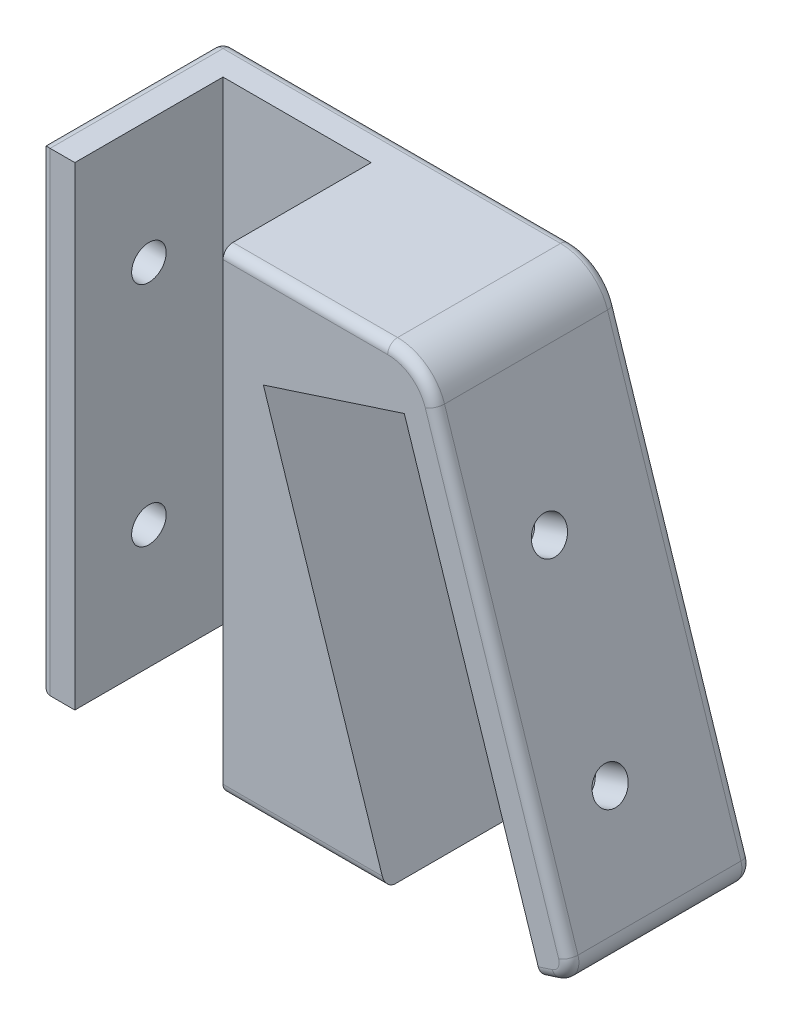
from build123d import *

# Parameters (mm, degrees)
BOSS_EXTRUDE1_DEPTH = 18.5
SKETCH2_W           = 15
SKETCH2_H           = 48
CUT_EXTRUDE1_DEPTH  = 15
SKETCH3_R           = 1.75
CUT_EXTRUDE2_DEPTH  = 3.5
SKETCH4_R           = 1.75
CUT_EXTRUDE3_DEPTH  = 4
SKETCH5_R           = 1.75
CUT_EXTRUDE4_DEPTH  = 4
CUT_EXTRUDE5_DEPTH  = 19
FILLET1_R           = 2
FILLET2_R           = 5
FILLET3_R           = 1


with BuildPart() as part:
    # Sketch1 → Boss-Extrude1 (new body)
    with BuildSketch(Plane.XY):
        Polygon((24.259932708, 13.808119809), (39.856078127, -34.191880191), (7.453399362, -34.191880191), (-14.546600638, -34.191880191), (-14.546600638, 13.808119809), align=None)
    extrude(amount=BOSS_EXTRUDE1_DEPTH)

    # Sketch2 → Cut-Extrude1 (cut)
    with BuildSketch(Plane.XY.offset(18.5)):
        with Locations((-3.546600638, -10.191880191)):
            Rectangle(SKETCH2_W, SKETCH2_H)
        Polygon((36.175960342, -34.191880191), (22.309194948, 8.485635376), (8.043347203, 3.85038046), (20.404026978, -34.191880191), align=None)
    extrude(amount=-CUT_EXTRUDE1_DEPTH, mode=Mode.SUBTRACT)

    # Sketch3 → Cut-Extrude2 (cut)
    with BuildSketch(Plane(origin=(26.001419868, 8.448373445, 0), x_dir=(0, 0, -1), z_dir=(0.9510565162951533, 0.3090169943749487, 0))):
        with Locations(Location((-11, -31.197396994, 0), (0, 0, 90))):
            Circle(SKETCH3_R)
        with Locations(Location((-11, -11.323601551, 0), (0, 0, 90))):
            Circle(SKETCH3_R)
    extrude(amount=-CUT_EXTRUDE2_DEPTH, mode=Mode.SUBTRACT)

    # Sketch4 → Cut-Extrude3 (cut)
    with BuildSketch(Plane(origin=(0, 0, 0), x_dir=(-1, 0, 0), z_dir=(0, 0, -1))):
        with Locations((-24.427281231, -22.303673738)):
            Circle(SKETCH4_R)
        with Locations((-19.038983505, -5.720198536)):
            Circle(SKETCH4_R)
        with Locations((3.546600638, 1.308119809)):
            Circle(SKETCH4_R)
        with Locations((3.546600638, -21.691880191)):
            Circle(SKETCH4_R)
    extrude(amount=-CUT_EXTRUDE3_DEPTH, mode=Mode.SUBTRACT)

    # Sketch5 → Cut-Extrude4 (cut)
    with BuildSketch(Plane.ZY.offset(14.546600638)):
        with Locations(Location((11, -21.691880191, 0), (0, 0, 270))):
            Circle(SKETCH5_R)
        with Locations(Location((11, 1.308119809, 0), (0, 0, 270))):
            Circle(SKETCH5_R)
    extrude(amount=-CUT_EXTRUDE4_DEPTH, mode=Mode.SUBTRACT)

    # Sketch6 → Cut-Extrude5 (cut)
    with BuildSketch(Plane.XY.offset(18.5)):
        Polygon((36.175960342, -34.191880191), (39.504658149, -33.110320711), (39.856078127, -34.191880191), align=None)
    extrude(amount=-CUT_EXTRUDE5_DEPTH, mode=Mode.SUBTRACT)

    # Fillet1
    fillet1_edges = [part.edges().sort_by_distance(p)[0] for p in [
        (39.504658149, -33.110320711, 9.25),
    ]]
    fillet(fillet1_edges, radius=FILLET1_R)

    # Fillet2
    fillet2_edges = [part.edges().sort_by_distance(p)[0] for p in [
        (24.259932708, 13.808119809, 9.25),
    ]]
    fillet(fillet2_edges, radius=FILLET2_R)

    # Fillet3
    fillet3_edges = [part.edges().sort_by_distance(p)[0] for p in [
        (36.889252729, -33.960117446, 18.5),
        (38.766524176, -32.734222667, 18.5),
        (32.134563405, -10.427501449, 18.5),
        (23.566146329, 12.85320478, 18.5),
        (36.889252729, -33.960117446, 0),
        (38.766524176, -32.734222667, 0),
        (32.134563405, -10.427501449, 0),
        (23.566146329, 12.85320478, 0),
        (12.17871317, -34.191880191, 18.5),
        (12.290309715, 13.808119809, 18.5),
        (-14.546600638, -34.191880191, 9.25),
        (-14.546600638, 13.808119809, 9.25),
        (-14.546600638, -10.191880191, 18.5),
        (10.814679852, -34.191880191, 0),
        (3.040309715, 13.808119809, 0),
        (-14.546600638, -10.191880191, 0),
    ]]
    fillet(fillet3_edges, radius=FILLET3_R)


solid = part.part
